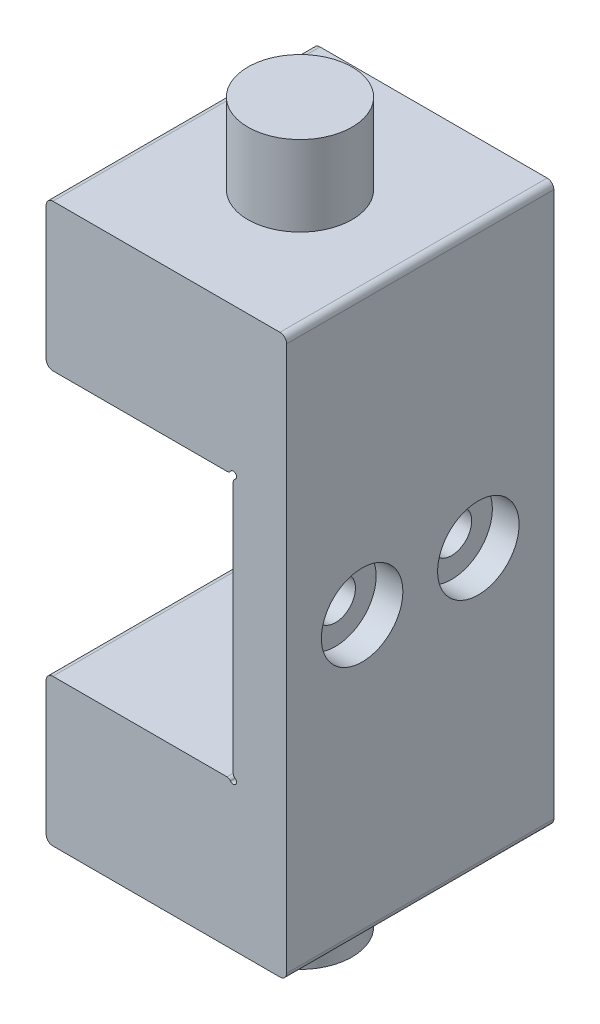
from build123d import *

# Parameters (mm, degrees)
BOSS_EXTRUDE1_DEPTH = 20
CUT_EXTRUDE3_REACH  = 41.302
SKETCH5_R           = 0.25
CUT_EXTRUDE4_REACH  = 42.898
SKETCH3_R           = 1.5
FILLET3_R           = 0.3
SKETCH12_R          = 3.9
BOSS_EXTRUDE3_DEPTH = 6
BOSS_EXTRUDE4_START = 6
SKETCH13_R          = 3.9
BOSS_EXTRUDE4_DEPTH = 6
FILLET4_R           = 0.5
SKETCH14_R          = 3.05
CUT_EXTRUDE5_DEPTH  = 2


with BuildPart() as part:
    # Sketch1 → Boss-Extrude1 (new body)
    with BuildSketch(Plane.XY):
        Polygon((0, 0), (-14, 0), (-14, -11), (4, -11), (4, 30.8), (-14, 30.8), (-14, 19.8), (0, 19.8), align=None)
    extrude(amount=BOSS_EXTRUDE1_DEPTH)

    # Sketch5 → Cut-Extrude3 (cut, up to next)
    with BuildSketch(Plane.XY.offset(20), mode=Mode.PRIVATE) as cut_extrude3_sk1:
        Circle(SKETCH5_R)
    cut_extrude3_tool1 = extrude(cut_extrude3_sk1.sketch, amount=-CUT_EXTRUDE3_REACH, mode=Mode.PRIVATE) & part.part
    # Sketch5 → Cut-Extrude3 (cut, up to next)
    with BuildSketch(Plane.XY.offset(20), mode=Mode.PRIVATE) as cut_extrude3_sk2:
        with Locations((0, 19.8)):
            Circle(SKETCH5_R)
    cut_extrude3_tool2 = extrude(cut_extrude3_sk2.sketch, amount=-CUT_EXTRUDE3_REACH, mode=Mode.PRIVATE) & part.part
    add(cut_extrude3_tool1.solids().sort_by_distance((0, 0, 20))[0], mode=Mode.SUBTRACT)
    add(cut_extrude3_tool2.solids().sort_by_distance((0, 19.8, 20))[0], mode=Mode.SUBTRACT)

    # Sketch3 → Cut-Extrude4 (cut, up to next)
    with BuildSketch(Plane(origin=(4, 0, 0), x_dir=(0, 0, -1), z_dir=(1, 0, 0)), mode=Mode.PRIVATE) as cut_extrude4_sk1:
        with Locations(Location((-5.65, 9.9, 0), (0, 0, 90))):
            Circle(SKETCH3_R)
    cut_extrude4_tool1 = extrude(cut_extrude4_sk1.sketch, amount=-CUT_EXTRUDE4_REACH, mode=Mode.PRIVATE) & part.part
    # Sketch3 → Cut-Extrude4 (cut, up to next)
    with BuildSketch(Plane(origin=(4, 0, 0), x_dir=(0, 0, -1), z_dir=(1, 0, 0)), mode=Mode.PRIVATE) as cut_extrude4_sk2:
        with Locations(Location((-14.35, 9.9, 0), (0, 0, 90))):
            Circle(SKETCH3_R)
    cut_extrude4_tool2 = extrude(cut_extrude4_sk2.sketch, amount=-CUT_EXTRUDE4_REACH, mode=Mode.PRIVATE) & part.part
    add(cut_extrude4_tool1.solids().sort_by_distance((4, 9.9, 5.65))[0], mode=Mode.SUBTRACT)
    add(cut_extrude4_tool2.solids().sort_by_distance((4, 9.9, 14.35))[0], mode=Mode.SUBTRACT)

    # Fillet3
    fillet3_edges = [part.edges().sort_by_distance(p)[0] for p in [
        (0, 0.25, 10),
        (-0.25, 0, 10),
        (0, 19.55, 10),
        (-0.25, 19.8, 10),
    ]]
    fillet(fillet3_edges, radius=FILLET3_R)

    # Sketch12 → Boss-Extrude3 (add)
    with BuildSketch(Plane.XZ.offset(11)):
        with Locations(Location((-5, 10, 0), (0, 0, 270))):
            Circle(SKETCH12_R)
    extrude(amount=BOSS_EXTRUDE3_DEPTH)

    # Sketch13 → Boss-Extrude4 (add)
    with BuildSketch(Plane(origin=(0, 30.8, 0), x_dir=(1, 0, 0), z_dir=(0, 1, 0)).offset(BOSS_EXTRUDE4_START)):
        with Locations(Location((-5, -10, 0), (0, 0, 90))):
            Circle(SKETCH13_R)
    extrude(amount=-BOSS_EXTRUDE4_DEPTH)

    # Fillet4
    fillet4_edges = [part.edges().sort_by_distance(p)[0] for p in [
        (-14, 19.8, 10),
        (-14, 30.8, 10),
        (4, 30.8, 10),
        (4, -11, 10),
        (-14, -11, 10),
        (-14, 0, 10),
    ]]
    fillet(fillet4_edges, radius=FILLET4_R)

    # Sketch14 → Cut-Extrude5 (cut)
    with BuildSketch(Plane(origin=(4, 0, 0), x_dir=(0, 0, -1), z_dir=(1, 0, 0))):
        with Locations(Location((-14.35, 9.9, 0), (0, 0, 90))):
            Circle(SKETCH14_R)
        with Locations(Location((-5.65, 9.9, 0), (0, 0, 90))):
            Circle(SKETCH14_R)
    extrude(amount=-CUT_EXTRUDE5_DEPTH, mode=Mode.SUBTRACT)


solid = part.part
